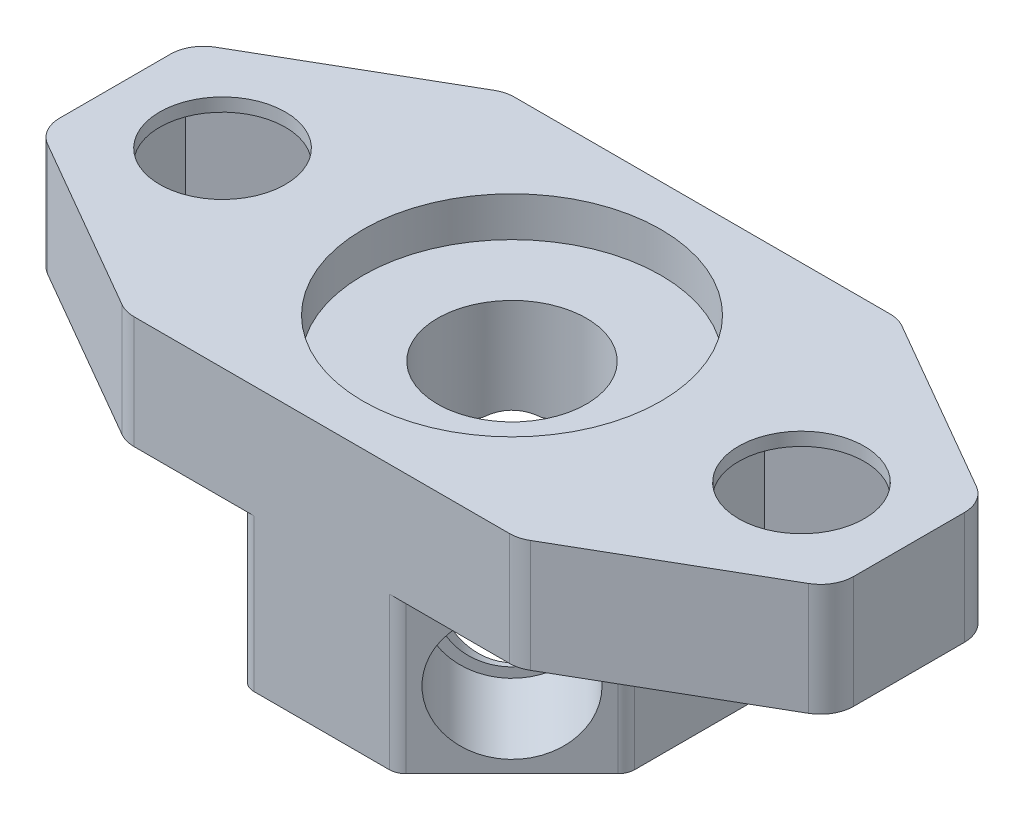
from build123d import *

# Parameters (mm, degrees)
ESBO_O10_W               = 11.5
ESBO_O10_H               = 11.5
ESBO_O10_R               = 2.5
RESSALTO_EXTRUS_O4_DEPTH = 8
CHANFRO2_SIZE            = 3.5
ESBO_O12_R               = 1.925
CORTE_EXTRUS_O4_DEPTH    = 3
ESBO_O17_R               = 1.925
CORTE_EXTRUS_O5_DEPTH    = 3
RESSALTO_EXTRUS_O5_START = -4.2
ESBO_O18_R               = 2.5
ESBO_O18_R_2             = 2.25
RESSALTO_EXTRUS_O5_DEPTH = 4.2
ESBO_O19_R               = 1.625
CORTE_EXTRUS_O6_DEPTH    = 14.431064984
ESBO_O20_R               = 1.625
CORTE_EXTRUS_O7_DEPTH    = 14.431065043
RESSALTO_EXTRUS_O6_START = -3.4
ESBO_O24_W               = 24
ESBO_O24_H               = 11.5
ESBO_O24_R               = 2.25
RESSALTO_EXTRUS_O6_DEPTH = 3.4
CORTE_EXTRUS_O8_DEPTH    = 3
ESBO_O26_R               = 1.9
CORTE_EXTRUS_O9_DEPTH    = 16.323919261
CORTE_EXTRUS_O10_DEPTH   = 15.079151286
FILETE3_R                = 1
FILETE4_R                = 0.5
ESBO_O30_R               = 4.5
CORTE_EXTRUS_O11_DEPTH   = 1.2


with BuildPart() as part:
    # Esboço10 → Ressalto-extrusão4 (new body)
    with BuildSketch(Plane(origin=(0, 0, 0), x_dir=(1, 0, 0), z_dir=(0, 1, 0))):
        Rectangle(ESBO_O10_W, ESBO_O10_H)
        with Locations(Location((0, 0, 0), (0, 0, 270))):
            Circle(ESBO_O10_R, mode=Mode.SUBTRACT)
    extrude(amount=RESSALTO_EXTRUS_O4_DEPTH)

    # Chanfro2
    chanfro2_edges = [part.edges().sort_by_distance(p)[0] for p in [
        (5.75, 4, 5.75),
        (-5.75, 4, 5.75),
        (-5.75, 4, -5.75),
        (5.75, 4, -5.75),
    ]]
    chamfer(chanfro2_edges, length=CHANFRO2_SIZE)

    # Esboço12 → Corte-extrusão4 (cut)
    with BuildSketch(Plane(origin=(-4, 0, 4), x_dir=(0.7071067811865465, 0, 0.7071067811865487), z_dir=(-0.7071067811865487, 0, 0.7071067811865465))):
        with Locations((0, 2.3)):
            Circle(ESBO_O12_R)
    corte_extrus_o4 = extrude(amount=-CORTE_EXTRUS_O4_DEPTH, mode=Mode.SUBTRACT)

    # Esboço17 → Corte-extrusão5 (cut)
    with BuildSketch(Plane(origin=(4, 0, 4), x_dir=(0.7071067811865489, 0, -0.7071067811865462), z_dir=(0.7071067811865462, 0, 0.7071067811865489))):
        with Locations((0, 2.3)):
            Circle(ESBO_O17_R)
    corte_extrus_o5 = extrude(amount=-CORTE_EXTRUS_O5_DEPTH, mode=Mode.SUBTRACT)

    # Espelhar1: Corte-extrusão4 across plane
    add(corte_extrus_o4.mirror(Plane.XY), mode=Mode.SUBTRACT)

    # Espelhar2: Corte-extrusão5 across plane
    add(corte_extrus_o5.mirror(Plane.XY), mode=Mode.SUBTRACT)

    # Esboço18 → Ressalto-extrusão5 (add)
    with BuildSketch(Plane(origin=(0, 8, 0), x_dir=(1, 0, 0), z_dir=(0, 1, 0)).offset(RESSALTO_EXTRUS_O5_START)):
        with Locations(Location((0, 0, 0), (0, 0, 270))):
            Circle(ESBO_O18_R)
        with Locations(Location((0, 0, 0), (0, 0, 270))):
            Circle(ESBO_O18_R_2, mode=Mode.SUBTRACT)
    extrude(amount=RESSALTO_EXTRUS_O5_DEPTH)

    # Esboço19 → Corte-extrusão6 (cut, through all)
    with BuildSketch(Plane(origin=(-1.878679656, 0, 1.878679656), x_dir=(0.7071067811865465, 0, 0.7071067811865486), z_dir=(-0.7071067811865486, 0, 0.7071067811865465))):
        with Locations(Location((0, 2.3, 0), (0, 0, 67.380135052))):
            Circle(ESBO_O19_R)
    extrude(amount=-CORTE_EXTRUS_O6_DEPTH, mode=Mode.SUBTRACT)

    # Esboço20 → Corte-extrusão7 (cut, through all)
    with BuildSketch(Plane(origin=(1.878679656, 0, 1.878679656), x_dir=(0.7071067811865488, 0, -0.7071067811865464), z_dir=(0.7071067811865464, 0, 0.7071067811865488))):
        with Locations((0, 2.3)):
            Circle(ESBO_O20_R)
    extrude(amount=-CORTE_EXTRUS_O7_DEPTH, mode=Mode.SUBTRACT)

    # Esboço24 → Ressalto-extrusão6 (add)
    with BuildSketch(Plane(origin=(0, 8, 0), x_dir=(1, 0, 0), z_dir=(0, 1, 0)).offset(RESSALTO_EXTRUS_O6_START)):
        Rectangle(ESBO_O24_W, ESBO_O24_H)
        with Locations(Location((0, 0, 0), (0, 0, 270))):
            Circle(ESBO_O24_R, mode=Mode.SUBTRACT)
    extrude(amount=RESSALTO_EXTRUS_O6_DEPTH)

    # Esboço25 → Corte-extrusão8 (cut)
    with BuildSketch(Plane.XZ.offset(-4.6)):
        Polygon((-8.75, 3.059956427), (-11.4, 1.529978213), (-11.4, -1.529978213), (-8.75, -3.059956427), (-6.1, -1.529978213), (-6.1, 1.529978213), align=None)
        Polygon((6.1, 1.529978213), (8.75, 3.059956427), (11.4, 1.529978213), (11.4, -1.529978213), (8.75, -3.059956427), (6.1, -1.529978213), align=None)
    extrude(amount=-CORTE_EXTRUS_O8_DEPTH, mode=Mode.SUBTRACT)

    # Esboço26 → Corte-extrusão9 (cut, through all)
    with BuildSketch(Plane.XZ.offset(-7.6)):
        with Locations(Location((-8.75, 0, 0), (0, 0, 270))):
            Circle(ESBO_O26_R)
        with Locations(Location((8.75, 0, 0), (0, 0, 90))):
            Circle(ESBO_O26_R)
    extrude(amount=-CORTE_EXTRUS_O9_DEPTH, mode=Mode.SUBTRACT)

    # Esboço27 → Corte-extrusão10 (cut, through all)
    with BuildSketch(Plane.XZ.offset(-4.6)):
        Polygon((-12, 5.75), (-12, 2.25), (-5.937822174, 5.75), align=None)
        Polygon((-5.937822174, -5.75), (-12, -5.75), (-12, -2.25), align=None)
        Polygon((12, -5.75), (12, -2.25), (5.937822174, -5.75), align=None)
        Polygon((5.937822174, 5.75), (12, 5.75), (12, 2.25), align=None)
    extrude(amount=-CORTE_EXTRUS_O10_DEPTH, mode=Mode.SUBTRACT)

    # Filete3
    filete3_edges = [part.edges().sort_by_distance(p)[0] for p in [
        (12, 6.3, 2.25),
        (5.937822174, 6.3, 5.75),
        (5.937822174, 6.3, -5.75),
        (12, 6.3, -2.25),
        (-12, 6.3, -2.25),
        (-5.937822174, 6.3, -5.75),
        (-5.937822174, 6.3, 5.75),
        (-12, 6.3, 2.25),
    ]]
    fillet(filete3_edges, radius=FILETE3_R)

    # Filete4
    filete4_edges = [part.edges().sort_by_distance(p)[0] for p in [
        (-2.25, 2.3, 5.75),
        (-5.75, 2.3, -2.25),
        (5.75, 2.3, 2.25),
        (2.25, 2.3, -5.75),
        (-2.25, 2.3, -5.75),
        (5.75, 2.3, -2.25),
        (2.25, 2.3, 5.75),
        (-5.75, 2.3, 2.25),
    ]]
    fillet(filete4_edges, radius=FILETE4_R)

    # Esboço30 → Corte-extrusão11 (cut)
    with BuildSketch(Plane(origin=(0, 8, 0), x_dir=(1, 0, 0), z_dir=(0, 1, 0))):
        with Locations(Location((0, 0, 0), (0, 0, 270))):
            Circle(ESBO_O30_R)
    extrude(amount=-CORTE_EXTRUS_O11_DEPTH, mode=Mode.SUBTRACT)


solid = part.part
